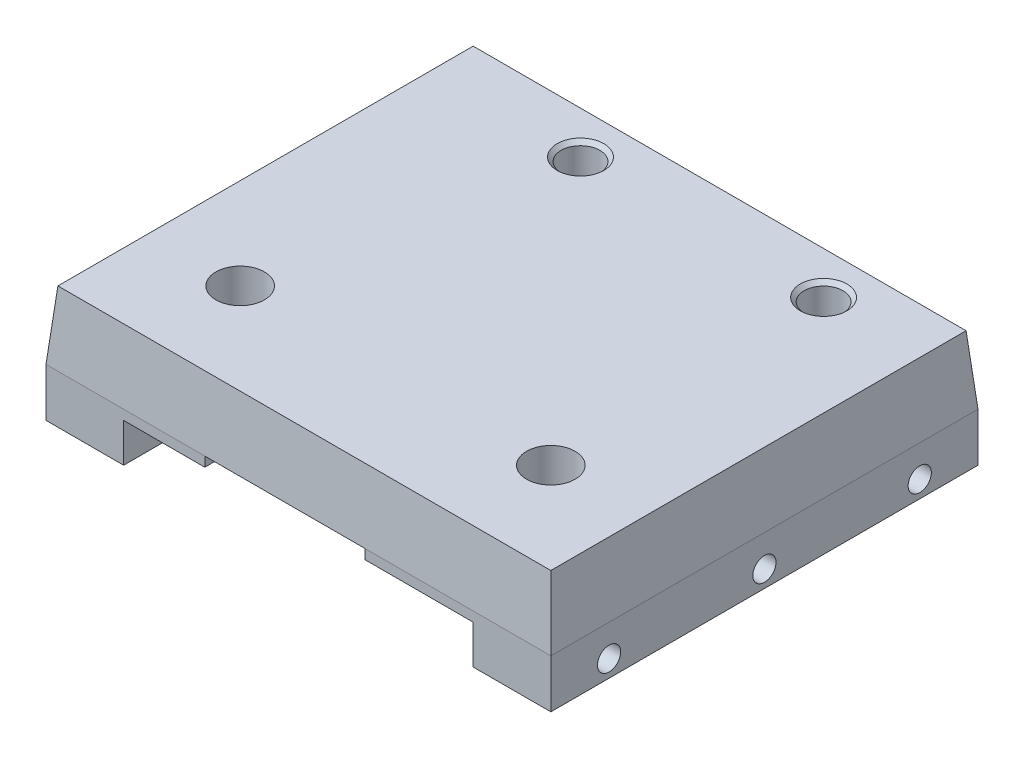
from build123d import *

# Parameters (mm, degrees)
SKETCH1_W                             = 82.55
SKETCH1_H                             = 69.85
BOSS_EXTRUDE1_DEPTH                   = 7.9375
SKETCH2_W                             = 82.55
SKETCH2_H                             = 69.85
BOSS_EXTRUDE2_DEPTH                   = 3.175
F_3_8_16_TAPPED_HOLE1_D               = 7.9375
F_3_8_16_TAPPED_HOLE1_DEPTH           = 9.525
F_3_8_16_TAPPED_HOLE1_TIP             = 2.384665582
DRAFT1_ANGLE                          = 5
SKETCH3_W                             = 12.7
SKETCH3_H                             = 69.85
BOSS_EXTRUDE3_DEPTH                   = 7.9375
SKETCH4_W                             = 13.267261336
SKETCH4_H                             = 69.85
SKETCH4_W_2                           = 17.684109612
WEAR_PADS_DEPTH                       = 1.5875
F_10_24_TAPPED_HOLE1_D                = 3.7973
F_10_24_TAPPED_HOLE1_DEPTH            = 12.7
F_1_4_0_25_DIAMETER_HOLE1_D           = 6.35
F_1_4_0_25_DIAMETER_HOLE1_DEPTH       = 8.89
F_1_4_0_25_DIAMETER_HOLE1_CSINK_D     = 7.62
F_1_4_0_25_DIAMETER_HOLE1_CSINK_ANGLE = 90
F_1_4_0_25_DIAMETER_HOLE1_TIP         = 1.907732465


with BuildPart() as part:
    # Sketch1 → Boss-Extrude1 (new body)
    with BuildSketch(Plane(origin=(0, 0, 0), x_dir=(1, 0, 0), z_dir=(0, 1, 0))):
        Rectangle(SKETCH1_W, SKETCH1_H)
    extrude(amount=BOSS_EXTRUDE1_DEPTH)

    # Sketch2 → Boss-Extrude2 (add)
    with BuildSketch(Plane(origin=(0, 7.9375, 0), x_dir=(1, 0, 0), z_dir=(0, 1, 0))):
        Rectangle(SKETCH2_W, SKETCH2_H)
    extrude(amount=BOSS_EXTRUDE2_DEPTH)

    # 3/8-16 Tapped Hole1
    with Locations(Plane(origin=(0, 11.1125, 0), x_dir=(1, 0, 0), z_dir=(0, 1, 0))):
        with Locations((-25.4, -19.05), (25.4, -19.05)):
            Hole(F_3_8_16_TAPPED_HOLE1_D / 2, depth=F_3_8_16_TAPPED_HOLE1_DEPTH)
            with Locations((0, 0, -(F_3_8_16_TAPPED_HOLE1_DEPTH + F_3_8_16_TAPPED_HOLE1_TIP / 2))):  # 118° drill point
                Cone(0, F_3_8_16_TAPPED_HOLE1_D / 2, F_3_8_16_TAPPED_HOLE1_TIP, mode=Mode.SUBTRACT)

    # Draft1
    draft1_faces = [part.faces().sort_by_distance(p)[0] for p in [
        (0, 5.55625, -34.925),
        (-41.275, 5.55625, 0),
        (0, 5.55625, 34.925),
        (41.275, 5.55625, 0),
    ]]
    draft(draft1_faces, Plane.ZX, DRAFT1_ANGLE)

    # Sketch3 → Boss-Extrude3 (add)
    with BuildSketch(Plane.XZ):
        with Locations((34.925, 0)):
            Rectangle(SKETCH3_W, SKETCH3_H)
        with Locations((-34.925, 0)):
            Rectangle(SKETCH3_W, SKETCH3_H)
    extrude(amount=BOSS_EXTRUDE3_DEPTH)

    # Sketch4 → Wear Pads (add)
    with BuildSketch(Plane.XZ):
        with Locations((-21.941369332, 0)):
            Rectangle(SKETCH4_W, SKETCH4_H)
        with Locations((19.732945194, 0)):
            Rectangle(SKETCH4_W_2, SKETCH4_H)
    extrude(amount=WEAR_PADS_DEPTH)

    # #10-24 Tapped Hole1
    with Locations(Plane(origin=(41.275, 0, 0), x_dir=(0, 0, -1), z_dir=(1, 0, 0))):
        with Locations((-25.4, -5.151627132), (25.4, -5.151627132), (0, -5.151627132)):
            Hole(F_10_24_TAPPED_HOLE1_D / 2, depth=F_10_24_TAPPED_HOLE1_DEPTH)

    # 1/4 (0.25) Diameter Hole1
    with Locations(Plane(origin=(0, 11.1125, 0), x_dir=(1, 0, 0), z_dir=(0, 1, 0))):
        with Locations((-15.817703685, 27.018390392), (23.931088267, 27.018390392)):
            CounterSinkHole(F_1_4_0_25_DIAMETER_HOLE1_D / 2, F_1_4_0_25_DIAMETER_HOLE1_CSINK_D / 2, depth=F_1_4_0_25_DIAMETER_HOLE1_DEPTH, counter_sink_angle=F_1_4_0_25_DIAMETER_HOLE1_CSINK_ANGLE)
            with Locations((0, 0, -(F_1_4_0_25_DIAMETER_HOLE1_DEPTH + F_1_4_0_25_DIAMETER_HOLE1_TIP / 2))):  # 118° drill point
                Cone(0, F_1_4_0_25_DIAMETER_HOLE1_D / 2, F_1_4_0_25_DIAMETER_HOLE1_TIP, mode=Mode.SUBTRACT)


solid = part.part
